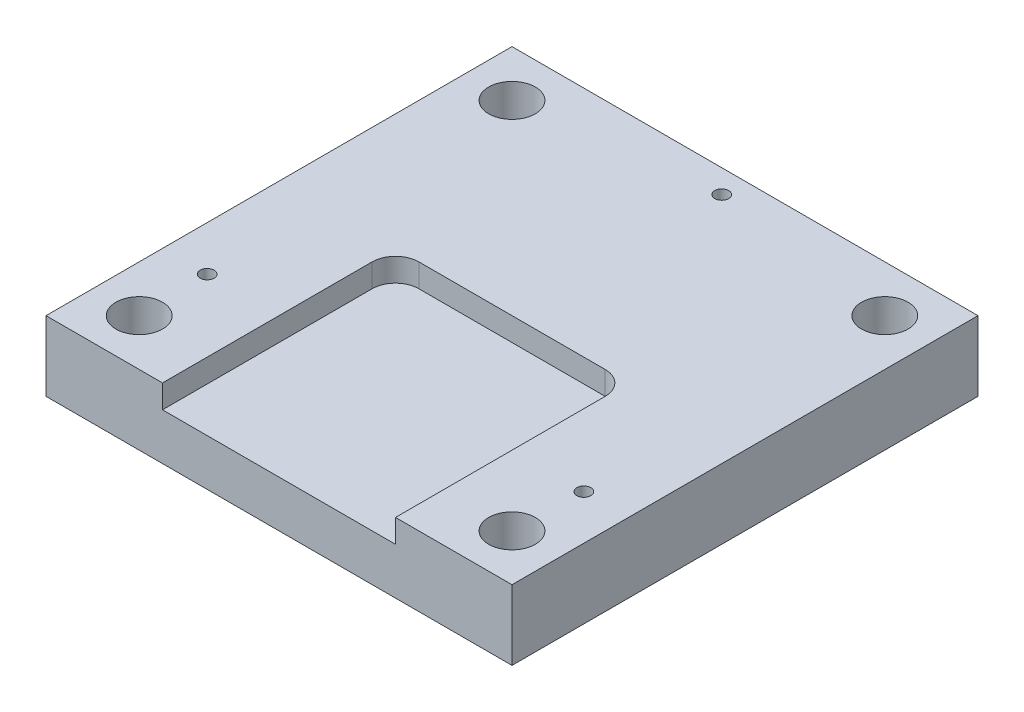
from build123d import *

# Parameters (mm, degrees)
SKETCH_1_W          = 100
SKETCH_1_H          = 100
EXTRUDE_1_DEPTH     = 15
SKETCH_2_R          = 1.5
CUT_EXTRUDE_1_DEPTH = 143.214626533
SKETCH_3_W          = 50
SKETCH_3_H          = 50
CUT_EXTRUDE_2_DEPTH = 5
SKETCH_4_R          = 5
CUT_EXTRUDE_3_DEPTH = 10
FILLET_1_R          = 5


with BuildPart() as part:
    # 草图1 → 凸台-拉伸1 (new body)
    with BuildSketch(Plane(origin=(0, 0, 0), x_dir=(1, 0, 0), z_dir=(0, 1, 0))):
        with Locations((50, -50)):
            Rectangle(SKETCH_1_W, SKETCH_1_H)
    extrude(amount=EXTRUDE_1_DEPTH)

    # 草图2 → 切除-拉伸1 (cut, through all)
    with BuildSketch(Plane(origin=(0, 15, 0), x_dir=(1, 0, 0), z_dir=(0, 1, 0))):
        with Locations(Location((50, -5, 0), (0, 0, 270))):
            Circle(SKETCH_2_R)
        with Locations(Location((9.585481157, -75, 0), (0, 0, 270))):
            Circle(SKETCH_2_R)
        with Locations(Location((90.414518843, -75, 0), (0, 0, 270))):
            Circle(SKETCH_2_R)
    extrude(amount=-CUT_EXTRUDE_1_DEPTH, mode=Mode.SUBTRACT)

    # 草图3 → 切除-拉伸2 (cut)
    with BuildSketch(Plane(origin=(0, 15, 0), x_dir=(1, 0, 0), z_dir=(0, 1, 0))):
        with Locations((50, -75)):
            Rectangle(SKETCH_3_W, SKETCH_3_H)
    extrude(amount=-CUT_EXTRUDE_2_DEPTH, mode=Mode.SUBTRACT)

    # 草图4 → 切除-拉伸3 (cut)
    with BuildSketch(Plane(origin=(0, 15, 0), x_dir=(1, 0, 0), z_dir=(0, 1, 0))):
        with Locations(Location((10, -10, 0), (0, 0, 270))):
            Circle(SKETCH_4_R)
        with Locations(Location((90, -10, 0), (0, 0, 270))):
            Circle(SKETCH_4_R)
        with Locations(Location((10, -90, 0), (0, 0, 270))):
            Circle(SKETCH_4_R)
        with Locations(Location((90, -90, 0), (0, 0, 270))):
            Circle(SKETCH_4_R)
    extrude(amount=-CUT_EXTRUDE_3_DEPTH, mode=Mode.SUBTRACT)

    # 圆角1
    fillet_1_edges = [part.edges().sort_by_distance(p)[0] for p in [
        (25, 12.5, 50),
        (75, 12.5, 50),
    ]]
    fillet(fillet_1_edges, radius=FILLET_1_R)


solid = part.part
